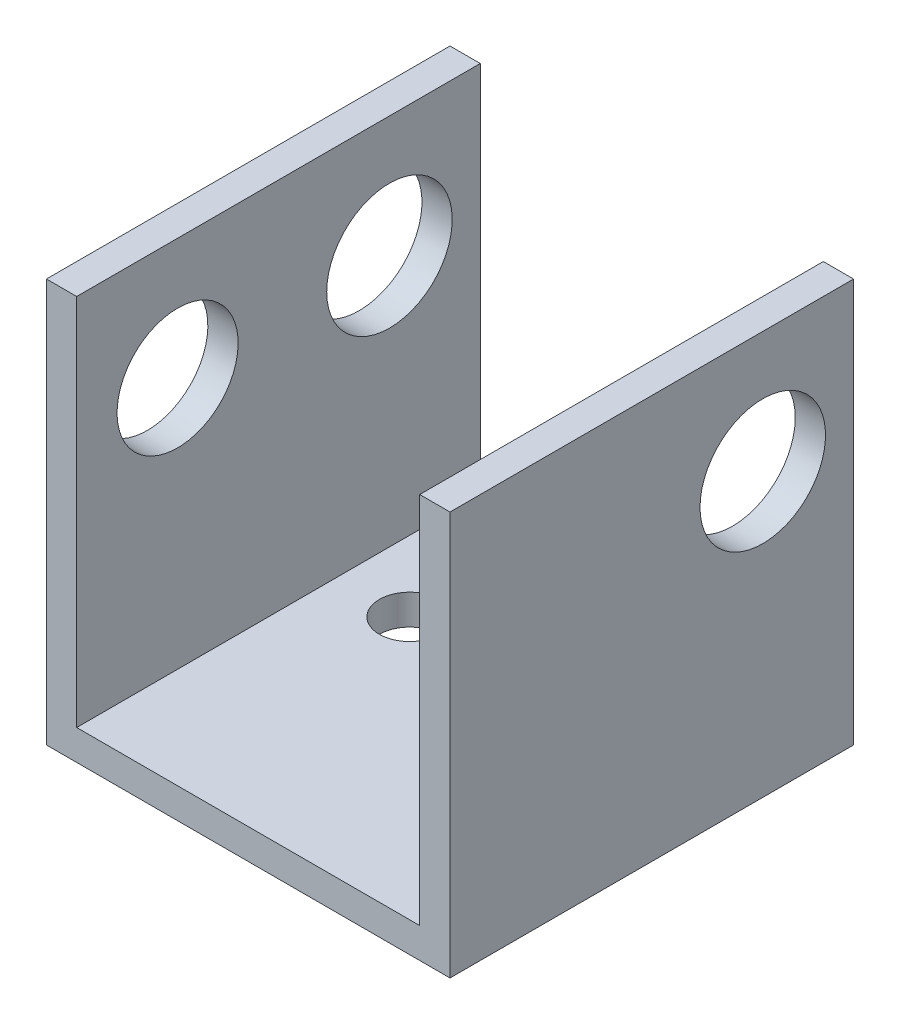
from build123d import *

# Parameters (mm, degrees)
EXTRUSION1_DEPTH = 20
ESQUISSE2_R      = 1.5
EXTRUSION2_DEPTH = 42.382154348
ESQUISSE4_R      = 3
EXTRUSION3_DEPTH = 32.911544508
ESQUISSE6_R      = 3.11
EXTRUSION4_DEPTH = 33.803912463


with BuildPart() as part:
    # Esquisse1 → Extrusion1 (new body)
    with BuildSketch(Plane.XY):
        Polygon((-31.14855853, 3.383843017), (-29.64855853, 3.383843017), (-29.64855853, -15.116156983), (-12.64855853, -15.116156983), (-12.64855853, 3.383843017), (-11.14855853, 3.383843017), (-11.14855853, -16.616156983), (-31.14855853, -16.616156983), align=None)
    extrude(amount=EXTRUSION1_DEPTH)

    # Esquisse2 → Extrusion2 (cut, through all)
    with BuildSketch(Plane(origin=(0, -15.116156983, 0), x_dir=(-1, 0, 0), z_dir=(0, 1, 0))):
        with Locations((26.14855853, 7)):
            Circle(ESQUISSE2_R)
        with Locations((16.14855853, 13)):
            Circle(ESQUISSE2_R)
    extrude(amount=-EXTRUSION2_DEPTH, mode=Mode.SUBTRACT)

    # Esquisse4 → Extrusion3 (cut, through all)
    with BuildSketch(Plane(origin=(-29.64855853, 0, 0), x_dir=(0, 0, -1), z_dir=(1, 0, 0))):
        with Locations(Location((-15, -2.616156983, 0), (0, 0, 90))):
            Circle(ESQUISSE4_R)
    extrude(amount=-EXTRUSION3_DEPTH, mode=Mode.SUBTRACT)

    # Esquisse6 → Extrusion4 (cut, through all)
    with BuildSketch(Plane.ZY.offset(31.14855853)):
        with Locations((4.5, -2.616156983)):
            Circle(ESQUISSE6_R)
    extrude(amount=-EXTRUSION4_DEPTH, mode=Mode.SUBTRACT)


solid = part.part
